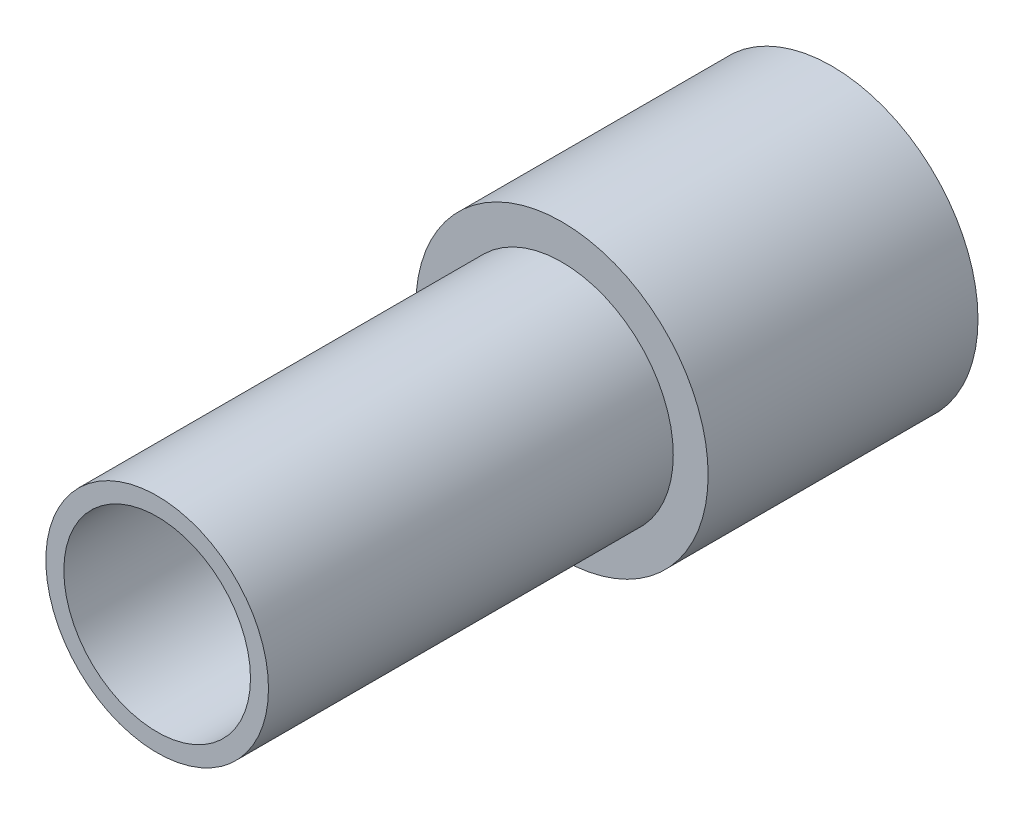
from build123d import *

# Parameters (mm, degrees)
SKETCH1_R           = 6.5
SKETCH1_R_2         = 4.15
BOSS_EXTRUDE1_DEPTH = 30
CUT_EXTRUDE1_START  = -18
SKETCH2_R           = 6.5
SKETCH2_R_2         = 4.95
CUT_EXTRUDE1_DEPTH  = 18


with BuildPart() as part:
    # Sketch1 → Boss-Extrude1 (new body)
    with BuildSketch(Plane.XY):
        Circle(SKETCH1_R)
        Circle(SKETCH1_R_2, mode=Mode.SUBTRACT)
    extrude(amount=BOSS_EXTRUDE1_DEPTH)

    # Sketch2 → Cut-Extrude1 (cut)
    with BuildSketch(Plane.XY.offset(30).offset(CUT_EXTRUDE1_START)):
        Circle(SKETCH2_R)
        Circle(SKETCH2_R_2, mode=Mode.SUBTRACT)
    extrude(amount=CUT_EXTRUDE1_DEPTH, mode=Mode.SUBTRACT)


solid = part.part
